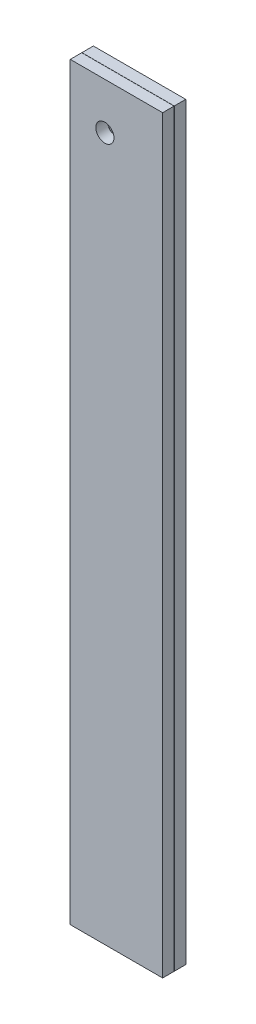
from build123d import *

# Parameters (mm, degrees)
SALIENTE_EXTRUIR1_DEPTH = 6.31
CROQUIS3_W              = 6.31
CROQUIS3_H              = 412.09566061
SALIENTE_EXTRUIR2_DEPTH = 50.8
CROQUIS4_R              = 5
CORTAR_EXTRUIR1_DEPTH   = 31


with BuildPart() as part:
    # Croquis2 → Saliente-Extruir1 (new body)
    with BuildSketch(Plane.XY):
        Polygon((0, 0), (50.8, 0), (50.8, -361.29566061), (50.8, -412.09566061), (0, -412.09566061), align=None)
    extrude(amount=SALIENTE_EXTRUIR1_DEPTH)


with BuildPart() as body_2:
    # Croquis3 → Saliente-Extruir2 (new body)
    with BuildSketch(Plane(origin=(50.8, 0, 0), x_dir=(0, 0, -1), z_dir=(1, 0, 0))):
        with Locations((-9.565, -206.047830305)):
            Rectangle(CROQUIS3_W, CROQUIS3_H)
    extrude(amount=-SALIENTE_EXTRUIR2_DEPTH)


with BuildPart() as cortar_extruir1_tool:
    # Croquis4 → Cortar-Extruir1 (new body)
    with BuildSketch(Plane.XY.offset(12.72)):
        with Locations((19.04, -25.4)):
            Circle(CROQUIS4_R)
    extrude(amount=-CORTAR_EXTRUIR1_DEPTH)


with BuildPart() as part_1:
    add(part.part)

    # Cortar-Extruir1: cut by cortar_extruir1_tool
    add(cortar_extruir1_tool.part, mode=Mode.SUBTRACT)


with BuildPart() as body_2_1:
    add(body_2.part)

    # Cortar-Extruir1: cut by cortar_extruir1_tool
    add(cortar_extruir1_tool.part, mode=Mode.SUBTRACT)


solid = Compound([part_1.part, body_2_1.part])
